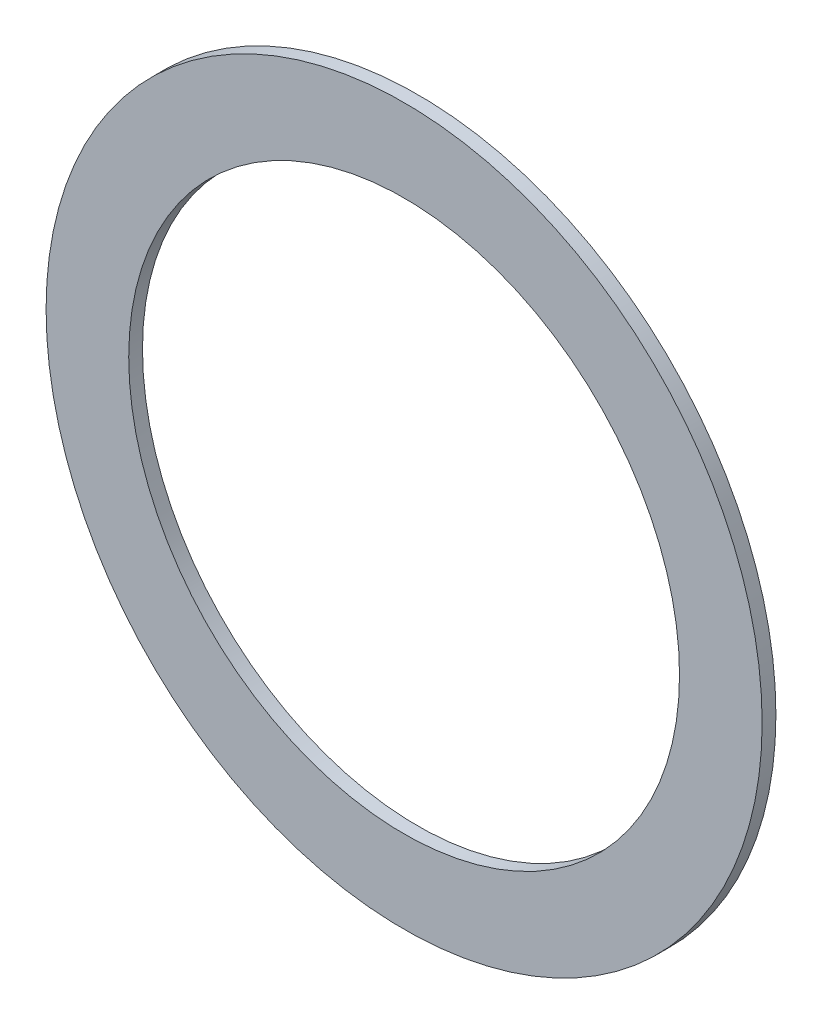
from build123d import *

# Parameters (mm, degrees)
ESQUISSE1_R          = 26
ESQUISSE1_R_2        = 20
BASE_EXTRUSION_DEPTH = 1


with BuildPart() as part:
    # Esquisse1 → Base-Extrusion (new body)
    with BuildSketch(Plane.XY):
        Circle(ESQUISSE1_R)
        Circle(ESQUISSE1_R_2, mode=Mode.SUBTRACT)
    extrude(amount=BASE_EXTRUSION_DEPTH)


solid = part.part
